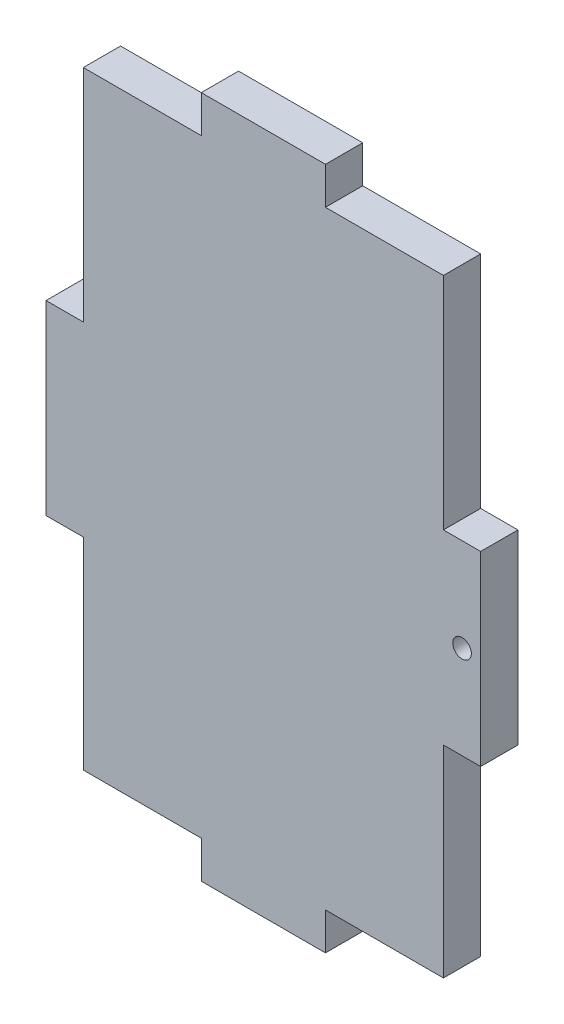
from build123d import *

# Parameters (mm, degrees)
ESQUISSE1_W             = 70
ESQUISSE1_H             = 110
BOSS_EXTRU_1_DEPTH      = 6
ENL_V_MAT_EXTRU_1_DEPTH = 131.522028792
ESQUISSE3_R             = 1.5
ENL_V_MAT_EXTRU_2_DEPTH = 131.522028792
ESQUISSE4_R             = 2.995
ENL_V_MAT_EXTRU_3_DEPTH = 3


with BuildPart() as part:
    # Esquisse1 → Boss.-Extru.1 (new body)
    with BuildSketch(Plane.XY):
        with Locations((-35, 55)):
            Rectangle(ESQUISSE1_W, ESQUISSE1_H)
    extrude(amount=BOSS_EXTRU_1_DEPTH)

    # Esquisse2 → Enlèv. mat.-Extru.1 (cut, through all)
    with BuildSketch(Plane(origin=(0, 0, 0), x_dir=(-1, 0, 0), z_dir=(0, 0, -1))):
        Polygon((0, 110), (25, 110), (25, 104), (6, 104), (6, 68.5), (0, 68.5), align=None)
        Polygon((70, 110), (45, 110), (45, 104), (64, 104), (64, 68.5), (70, 68.5), align=None)
        Polygon((0, 0), (25, 0), (25, 6), (6, 6), (6, 38.5), (0, 38.5), align=None)
        Polygon((45, 0), (70, 0), (70, 38.5), (64, 38.5), (64, 6), (45, 6), align=None)
    extrude(amount=-ENL_V_MAT_EXTRU_1_DEPTH, mode=Mode.SUBTRACT)

    # Esquisse3 → Enlèv. mat.-Extru.2 (cut, through all)
    with BuildSketch(Plane(origin=(0, 0, 0), x_dir=(-1, 0, 0), z_dir=(0, 0, -1))):
        with Locations((3, 53.5)):
            Circle(ESQUISSE3_R)
    extrude(amount=-ENL_V_MAT_EXTRU_2_DEPTH, mode=Mode.SUBTRACT)

    # Esquisse4 → Enlèv. mat.-Extru.3 (cut)
    with BuildSketch(Plane(origin=(0, 0, 0), x_dir=(-1, 0, 0), z_dir=(0, 0, -1))):
        with Locations((3, 53.5)):
            Circle(ESQUISSE4_R)
    extrude(amount=-ENL_V_MAT_EXTRU_3_DEPTH, mode=Mode.SUBTRACT)


solid = part.part
